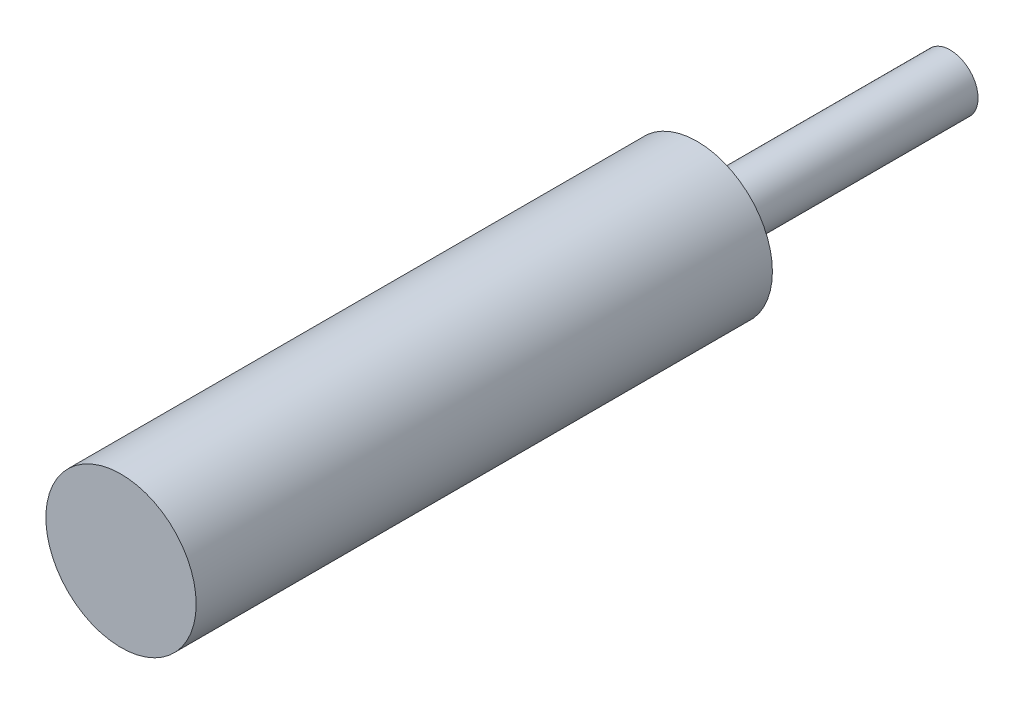
from build123d import *

# Parameters (mm, degrees)
SKETCH2_R           = 2.325
BOSS_EXTRUDE1_DEPTH = 25.65
CUT_EXTRUDE1_START  = -7.825
SKETCH3_R           = 2.325
SKETCH3_R_2         = 0.86184899
CUT_EXTRUDE1_DEPTH  = 7.825


with BuildPart() as part:
    # Sketch2 → Boss-Extrude1 (new body)
    with BuildSketch(Plane.XY):
        Circle(SKETCH2_R)
    extrude(amount=-BOSS_EXTRUDE1_DEPTH)

    # Sketch3 → Cut-Extrude1 (cut)
    with BuildSketch(Plane(origin=(0, 0, -25.65), x_dir=(-1, 0, 0), z_dir=(0, 0, -1)).offset(CUT_EXTRUDE1_START)):
        with Locations(Location((0, 0, 0), (0, 0, 180))):
            Circle(SKETCH3_R)
        Circle(SKETCH3_R_2, mode=Mode.SUBTRACT)
    extrude(amount=CUT_EXTRUDE1_DEPTH, mode=Mode.SUBTRACT)


solid = part.part
